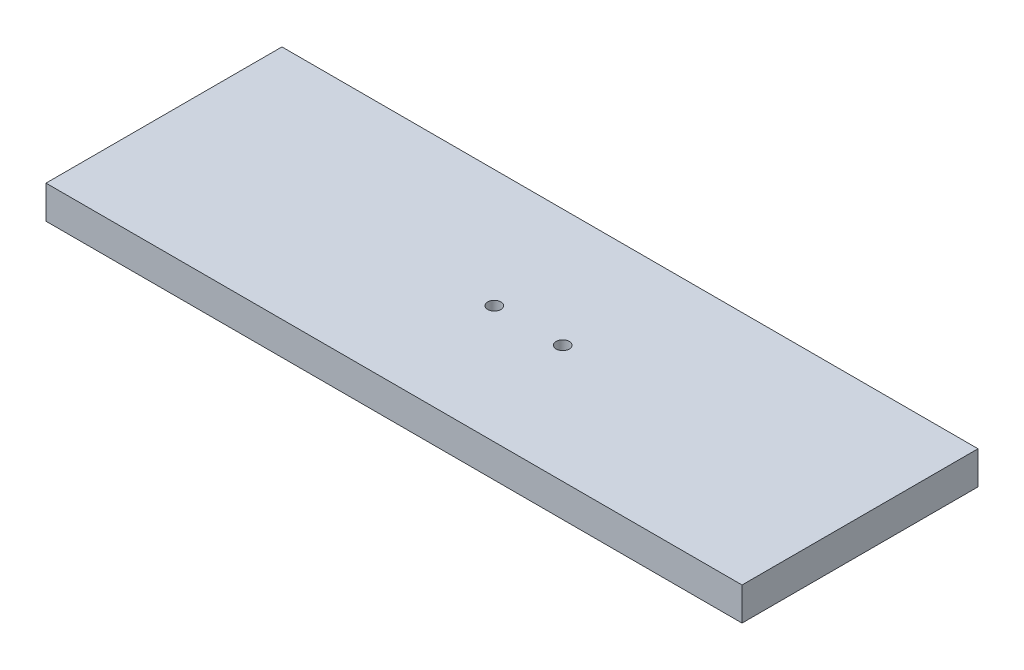
from build123d import *

# Parameters (mm, degrees)
SKETCH1_W           = 374.65
SKETCH1_H           = 17.78
BOSS_EXTRUDE1_DEPTH = 127
SKETCH2_R           = 3.556
CUT_EXTRUDE1_DEPTH  = 228.014942295


with BuildPart() as part:
    # Sketch1 → Boss-Extrude1 (new body)
    with BuildSketch(Plane.XY):
        Rectangle(SKETCH1_W, SKETCH1_H)
    extrude(amount=BOSS_EXTRUDE1_DEPTH)

    # Sketch2 → Cut-Extrude1 (cut, through all)
    with BuildSketch(Plane.XZ.offset(8.89)):
        with Locations(Location((-9.525, 63.5, 0), (0, 0, 270))):
            Circle(SKETCH2_R)
        with Locations(Location((27.305, 63.5, 0), (0, 0, 270))):
            Circle(SKETCH2_R)
    extrude(amount=-CUT_EXTRUDE1_DEPTH, mode=Mode.SUBTRACT)


solid = part.part
